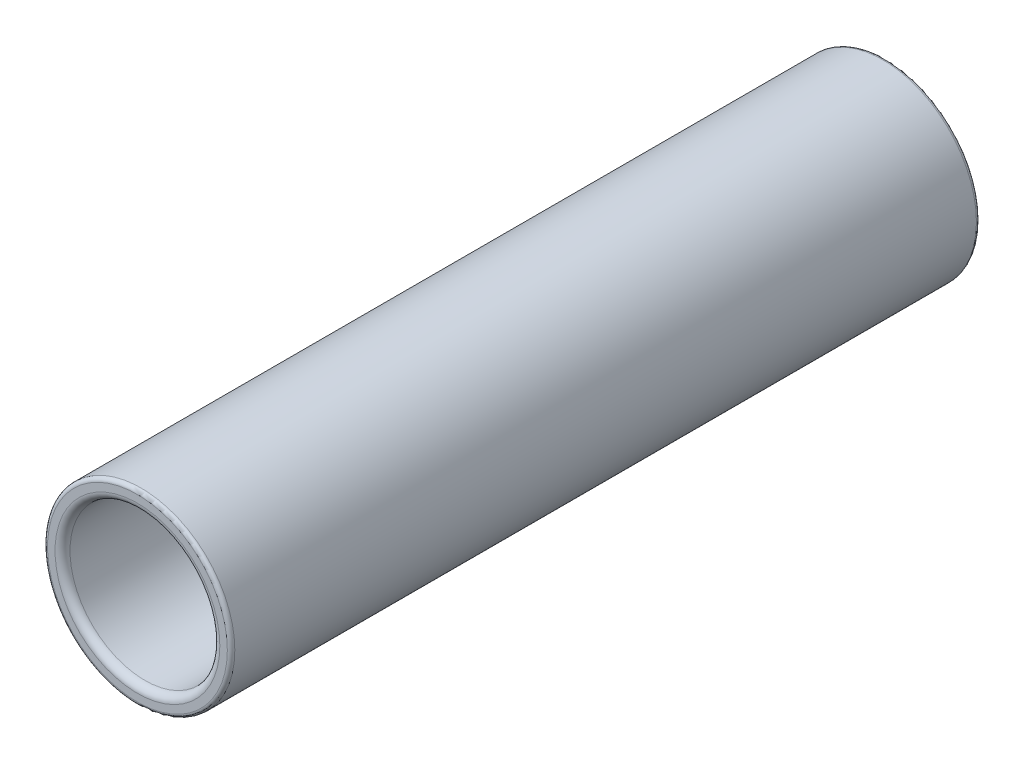
from build123d import *

# Parameters (mm, degrees)
CROQUIS1_R              = 2.5
CROQUIS1_R_2            = 2
SALIENTE_EXTRUIR2_DEPTH = 20
REDONDEO5_R             = 0.1
REDONDEO6_R             = 0.2


with BuildPart() as part:
    # Croquis1 → Saliente-Extruir2 (new body)
    with BuildSketch(Plane.XY):
        Circle(CROQUIS1_R)
        Circle(CROQUIS1_R_2, mode=Mode.SUBTRACT)
    extrude(amount=SALIENTE_EXTRUIR2_DEPTH)

    # Redondeo5
    redondeo5_edges = [part.edges().sort_by_distance(p)[0] for p in [
        (-2.5, 0, 0),
        (-2.5, 0, 20),
    ]]
    fillet(redondeo5_edges, radius=REDONDEO5_R)

    # Redondeo6
    redondeo6_edges = [part.edges().sort_by_distance(p)[0] for p in [
        (-2, 0, 0),
        (-2, 0, 20),
    ]]
    fillet(redondeo6_edges, radius=REDONDEO6_R)


solid = part.part
